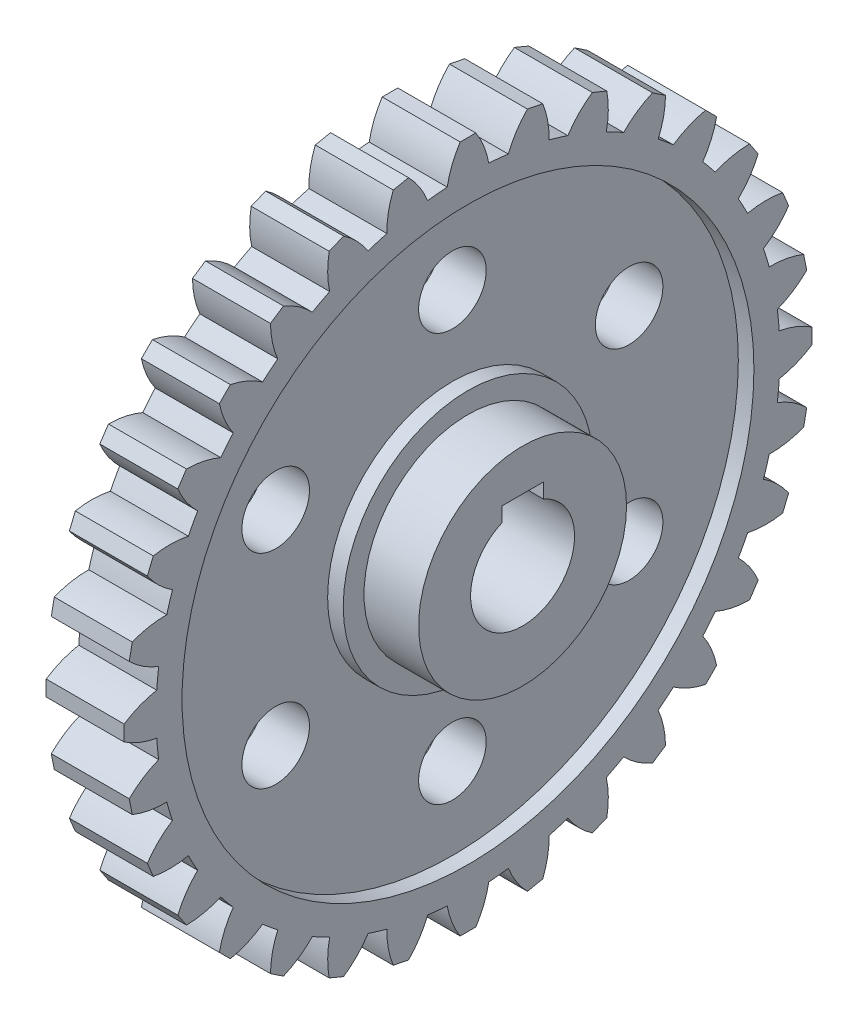
from build123d import *

# Parameters (mm, degrees)
SKETCH1_R           = 60
BOSS_EXTRUDE1_DEPTH = 7.5
BOSS_EXTRUDE2_DEPTH = 15
CIRPATTERN1_COUNT   = 32
SKETCH3_R           = 20
BOSS_EXTRUDE3_DEPTH = 18
CUT_EXTRUDE1_DEPTH  = 101.220148055
SKETCH5_R           = 55
SKETCH5_R_2         = 24
CUT_EXTRUDE6_DEPTH  = 3
SKETCH6_R           = 6.5
CUT_EXTRUDE7_DEPTH  = 97.199418274


with BuildPart() as part:
    # Sketch1 → Boss-Extrude1 (new, symmetric)
    with BuildSketch(Plane(origin=(0, 0, 0), x_dir=(0, 0, -1), z_dir=(1, 0, 0))):
        Circle(SKETCH1_R)
    extrude(amount=BOSS_EXTRUDE1_DEPTH, both=True)

    # Sketch2 → Boss-Extrude2 (add)
    with BuildSketch(Plane(origin=(7.5, 0, 0), x_dir=(0, 0, -1), z_dir=(1, 0, 0))):
        with BuildLine():
            Line((-1.5, 66.136518188), (1.5, 66.136518188))
            ThreePointArc((1.5, 66.136518188), (3.064324573, 63.126846965), (4, 59.866518188))
            ThreePointArc((4, 59.866518188), (0, 60), (-4, 59.866518188))
            ThreePointArc((-4, 59.866518188), (-3.064324573, 63.126846965), (-1.5, 66.136518188))
        make_face()
    boss_extrude2 = extrude(amount=-BOSS_EXTRUDE2_DEPTH)

    # CirPattern1: Boss-Extrude2 ×32 about axis
    cirpattern1_axis = Axis((0, 0, 0), (1, 0, 0))
    for i in range(1, CIRPATTERN1_COUNT):
        add(boss_extrude2.rotate(cirpattern1_axis, i * 360 / CIRPATTERN1_COUNT))

    # Sketch3 → Boss-Extrude3 (add, symmetric)
    with BuildSketch(Plane(origin=(0, 0, 0), x_dir=(0, 0, -1), z_dir=(1, 0, 0))):
        Circle(SKETCH3_R)
    extrude(amount=BOSS_EXTRUDE3_DEPTH, both=True)

    # Sketch4 → Cut-Extrude1 (cut, through all)
    with BuildSketch(Plane(origin=(18, 0, 0), x_dir=(0, 0, -1), z_dir=(1, 0, 0))):
        with BuildLine():
            Line((-4, 12), (4, 12))
            Line((4, 12), (4, 9.16515139))
            ThreePointArc((4, 9.16515139), (0, -10), (-4, 9.16515139))
            Line((-4, 9.16515139), (-4, 12))
        make_face()
    extrude(amount=-CUT_EXTRUDE1_DEPTH, mode=Mode.SUBTRACT)

    # Sketch5 → Cut-Extrude6 (cut)
    with BuildSketch(Plane(origin=(7.5, 0, 0), x_dir=(0, 0, -1), z_dir=(1, 0, 0))):
        Circle(SKETCH5_R)
        Circle(SKETCH5_R_2, mode=Mode.SUBTRACT)
    cut_extrude6 = extrude(amount=-CUT_EXTRUDE6_DEPTH, mode=Mode.SUBTRACT)

    # Sketch6 → Cut-Extrude7 (cut, through all)
    with BuildSketch(Plane(origin=(4.5, 0, 0), x_dir=(0, 0, -1), z_dir=(1, 0, 0))):
        with Locations((0, 39.25)):
            Circle(SKETCH6_R)
        with Locations((33.991497099, 19.625)):
            Circle(SKETCH6_R)
        with Locations((33.991497099, -19.625)):
            Circle(SKETCH6_R)
        with Locations((0, -39.25)):
            Circle(SKETCH6_R)
        with Locations((-33.991497099, -19.625)):
            Circle(SKETCH6_R)
        with Locations((-33.991497099, 19.625)):
            Circle(SKETCH6_R)
    extrude(amount=-CUT_EXTRUDE7_DEPTH, mode=Mode.SUBTRACT)

    # Mirror1: Cut-Extrude6 across plane
    add(cut_extrude6.mirror(Plane(origin=(0, 0, 0), x_dir=(0, 0, 1), z_dir=(1, 0, 0))), mode=Mode.SUBTRACT)


solid = part.part
